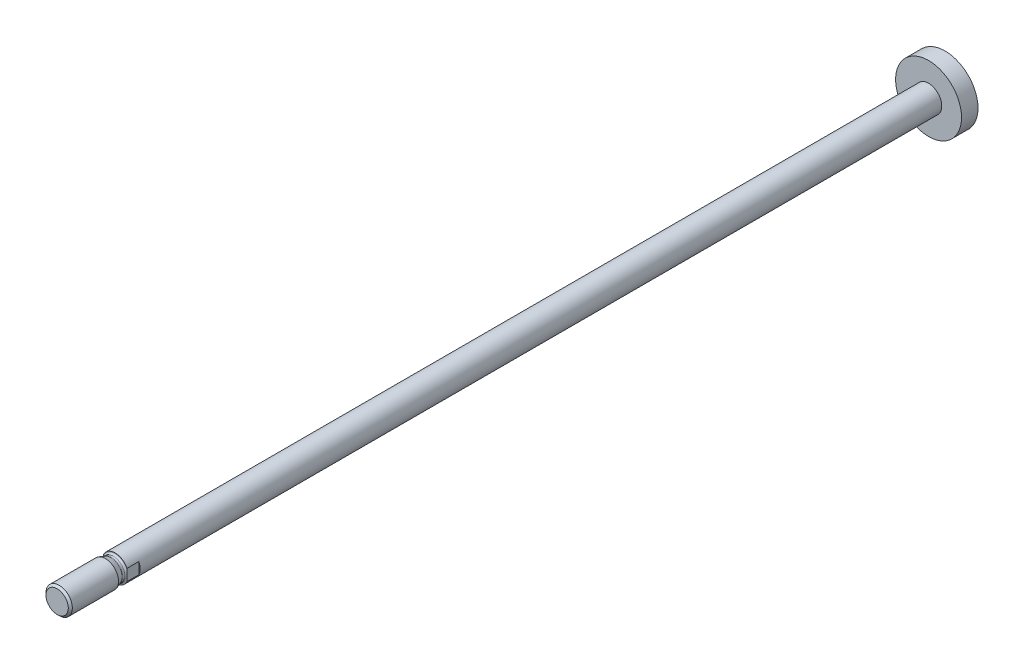
from build123d import *

# Parameters (mm, degrees)
SCHNITT_LINEAR_AUSTRAGEN1_DEPTH = 5.5


with BuildPart() as part:
    # Skizze1 → Rotation1 (revolve)
    with BuildSketch(Plane(origin=(0, 0, 0), x_dir=(0, 0, -1), z_dir=(1, 0, 0))):
        Polygon((-6, 0), (-6, 5), (302.6, 5), (302.6, 12.5), (308.85, 12.5), (308.85, 0), align=None)
    revolve(axis=Axis((0, 0, -308.85), (0, 0, 1)))

    # Skizze2 → Rotation2 (revolve)
    with BuildSketch(Plane(origin=(0, 0, 0), x_dir=(0, 0, -1), z_dir=(1, 0, 0))):
        with BuildLine():
            Line((-28, 0), (-28, 4.233))
            Line((-28, 4.233), (-27.233, 5))
            Line((-27.233, 5), (-9.697981936, 5))
            Line((-9.697981936, 5), (-7.599415898, 4.236184428))
            ThreePointArc((-7.599415898, 4.236184428), (-7.498392718, 4.209115348), (-7.394203812, 4.2))
            Line((-7.394203812, 4.2), (-6.6, 4.2))
            ThreePointArc((-6.6, 4.2), (-6.175735931, 4.375735931), (-6, 4.8))
            Line((-6, 4.8), (-6, 5))
            Line((-6, 5), (-5, 5))
            Line((-5, 5), (-5, 0))
            Line((-5, 0), (-28, 0))
        make_face()
    revolve(axis=Axis((0, 0, 5), (0, 0, 1)))

    # Skizze3 → Schnitt-Linear austragen1 (cut)
    with BuildSketch(Plane.XY.offset(1.5)):
        Polygon((-9, 18), (-9, -9), (-4.5, -9), (-4.5, 9), (4.5, 9), (4.5, -9), (9, -9), (9, 18), align=None)
    extrude(amount=SCHNITT_LINEAR_AUSTRAGEN1_DEPTH, mode=Mode.SUBTRACT)


solid = part.part
